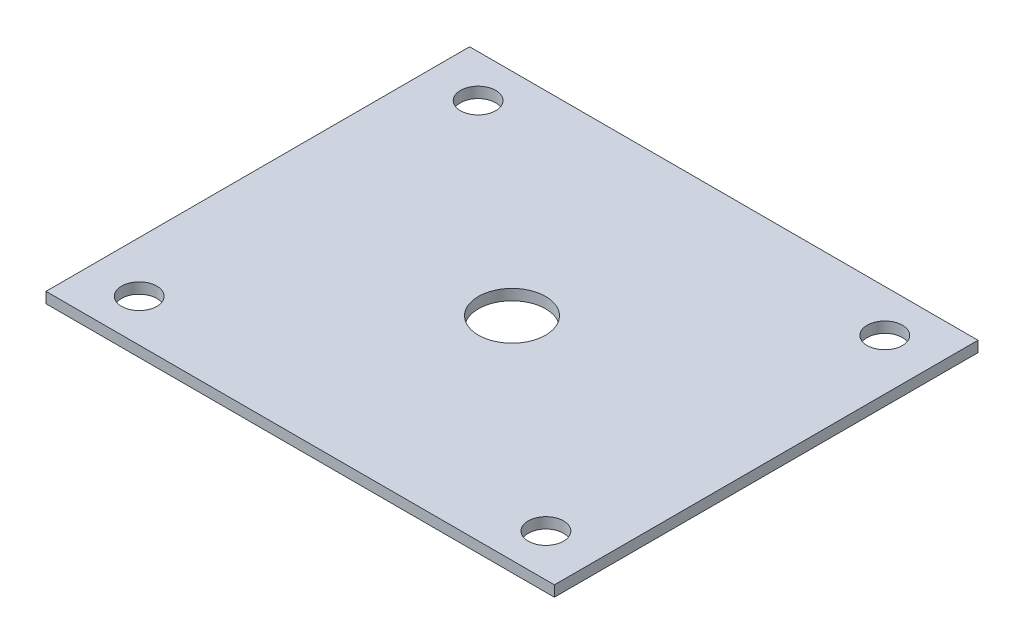
from build123d import *

# Parameters (mm, degrees)
BOSS_EXTRUDE1_DEPTH      = 0.79375
BOSS_EXTRUDE1_DEPTH_BACK = 0.79375
SKETCH1_W                = 75
SKETCH1_H                = 62.5
SKETCH1_R                = 4.955
SKETCH1_R_2              = 2.6


with BuildPart() as part:
    # Sketch1 → Boss-Extrude1 (new, two sides: drawn at the far end of the back side and taken through both)
    with BuildSketch(Plane(origin=(0, 0, 0), x_dir=(1, 0, 0), z_dir=(0, 1, 0)).offset(-BOSS_EXTRUDE1_DEPTH_BACK)):
        Rectangle(SKETCH1_W, SKETCH1_H)
        Circle(SKETCH1_R, mode=Mode.SUBTRACT)
        with Locations((30, 25)):
            Circle(SKETCH1_R_2, mode=Mode.SUBTRACT)
        with Locations((-30, 25)):
            Circle(SKETCH1_R_2, mode=Mode.SUBTRACT)
        with Locations((-30, -25)):
            Circle(SKETCH1_R_2, mode=Mode.SUBTRACT)
        with Locations((30, -25)):
            Circle(SKETCH1_R_2, mode=Mode.SUBTRACT)
    extrude(amount=BOSS_EXTRUDE1_DEPTH + BOSS_EXTRUDE1_DEPTH_BACK)


solid = part.part
